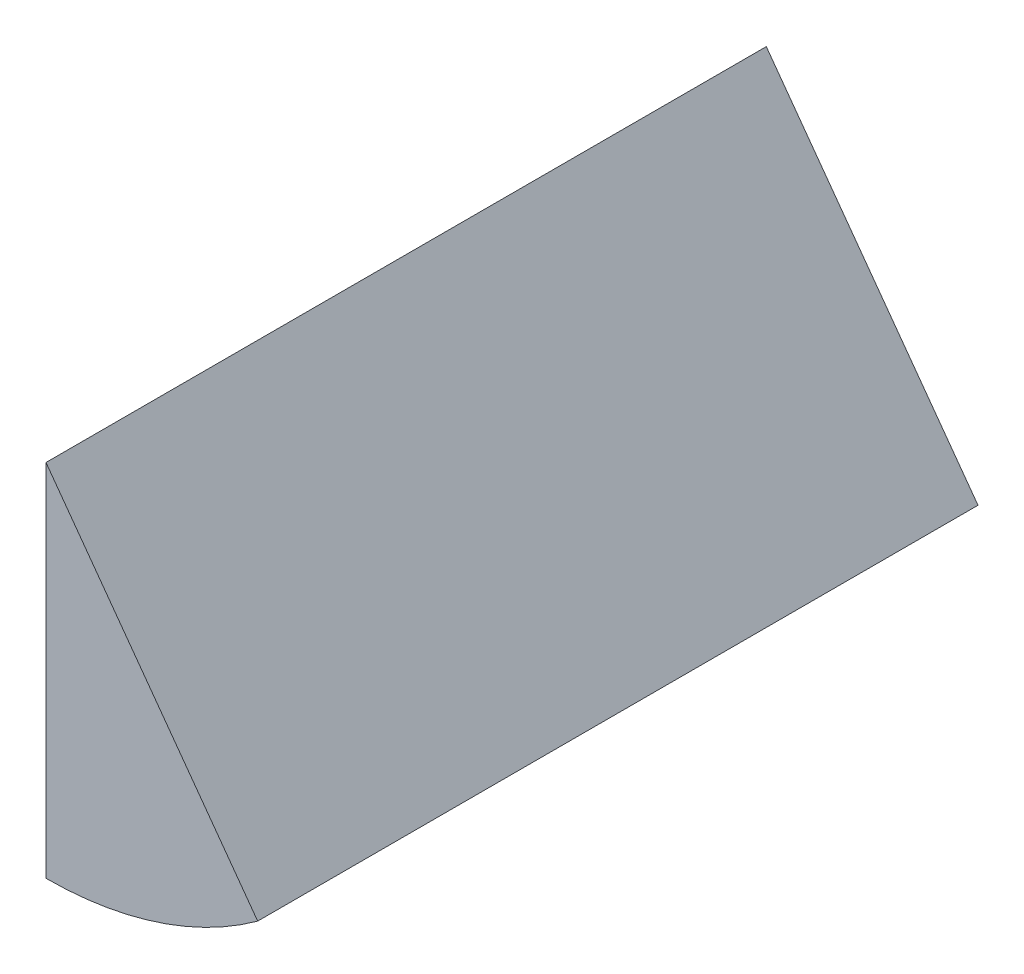
from build123d import *

# Parameters (mm, degrees)
SALIENTE_EXTRUIR1_DEPTH = 50
CROQUIS2_R              = 5.032013792
CORTAR_EXTRUIR1_DEPTH   = 10


with BuildPart() as part:
    # Croquis1 → Saliente-Extruir1 (new body)
    with BuildSketch(Plane.XY):
        with BuildLine():
            Line((0, 0), (0, -25))
            ThreePointArc((0, -25), (7.725424859, -23.776412907), (14.694631307, -20.225424859))
            Line((14.694631307, -20.225424859), (0, 0))
        make_face()
    extrude(amount=SALIENTE_EXTRUIR1_DEPTH)

    # Croquis2 → Cortar-Extruir1 (cut)
    with BuildSketch(Plane(origin=(0, 0, 0), x_dir=(-1, 0, 0), z_dir=(0, 0, -1))):
        with Locations((-5.939812616, -18.149032461)):
            Circle(CROQUIS2_R)
    extrude(amount=-CORTAR_EXTRUIR1_DEPTH, mode=Mode.SUBTRACT)


solid = part.part
